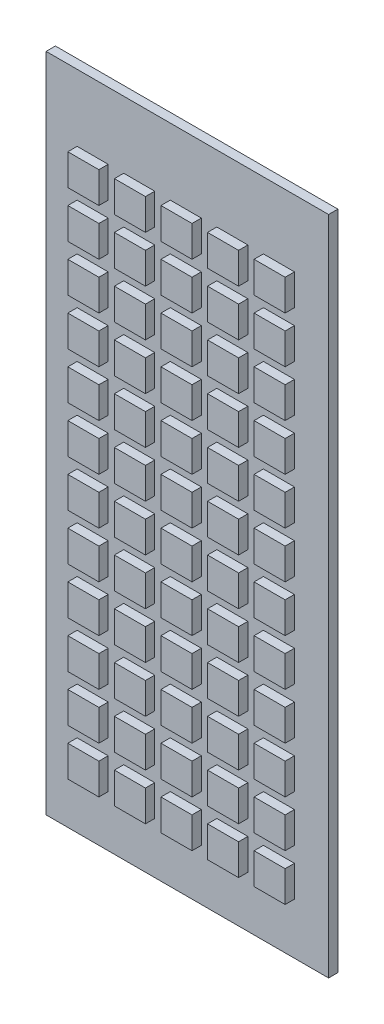
from build123d import *

# Parameters (mm, degrees)
CROQUIS1_W              = 910
CROQUIS1_H              = 2130
SALIENTE_EXTRUIR1_DEPTH = 30
CROQUIS2_W              = 100
CROQUIS2_H              = 100
SALIENTE_EXTRUIR2_DEPTH = 30


with BuildPart() as part:
    # Croquis1 → Saliente-Extruir1 (new body)
    with BuildSketch(Plane.XY):
        Rectangle(CROQUIS1_W, CROQUIS1_H)
    extrude(amount=SALIENTE_EXTRUIR1_DEPTH)

    # Croquis2 → Saliente-Extruir2 (add)
    with BuildSketch(Plane.XY.offset(30)):
        with Locations((-305, 800)):
            Rectangle(CROQUIS2_W, CROQUIS2_H)
        with Locations((-155, 800)):
            Rectangle(CROQUIS2_W, CROQUIS2_H)
        with Locations((-5, 800)):
            Rectangle(CROQUIS2_W, CROQUIS2_H)
        with Locations((145, 800)):
            Rectangle(CROQUIS2_W, CROQUIS2_H)
        with Locations((295, 800)):
            Rectangle(CROQUIS2_W, CROQUIS2_H)
        with Locations((-155, 650)):
            Rectangle(CROQUIS2_W, CROQUIS2_H)
        with Locations((-5, 650)):
            Rectangle(CROQUIS2_W, CROQUIS2_H)
        with Locations((145, 650)):
            Rectangle(CROQUIS2_W, CROQUIS2_H)
        with Locations((295, 650)):
            Rectangle(CROQUIS2_W, CROQUIS2_H)
        with Locations((-155, 500)):
            Rectangle(CROQUIS2_W, CROQUIS2_H)
        with Locations((-5, 500)):
            Rectangle(CROQUIS2_W, CROQUIS2_H)
        with Locations((145, 500)):
            Rectangle(CROQUIS2_W, CROQUIS2_H)
        with Locations((295, 500)):
            Rectangle(CROQUIS2_W, CROQUIS2_H)
        with Locations((-155, 350)):
            Rectangle(CROQUIS2_W, CROQUIS2_H)
        with Locations((-5, 350)):
            Rectangle(CROQUIS2_W, CROQUIS2_H)
        with Locations((145, 350)):
            Rectangle(CROQUIS2_W, CROQUIS2_H)
        with Locations((295, 350)):
            Rectangle(CROQUIS2_W, CROQUIS2_H)
        with Locations((-155, 200)):
            Rectangle(CROQUIS2_W, CROQUIS2_H)
        with Locations((-5, 200)):
            Rectangle(CROQUIS2_W, CROQUIS2_H)
        with Locations((145, 200)):
            Rectangle(CROQUIS2_W, CROQUIS2_H)
        with Locations((295, 200)):
            Rectangle(CROQUIS2_W, CROQUIS2_H)
        with Locations((-155, 50)):
            Rectangle(CROQUIS2_W, CROQUIS2_H)
        with Locations((-5, 50)):
            Rectangle(CROQUIS2_W, CROQUIS2_H)
        with Locations((145, 50)):
            Rectangle(CROQUIS2_W, CROQUIS2_H)
        with Locations((295, 50)):
            Rectangle(CROQUIS2_W, CROQUIS2_H)
        with Locations((-155, -100)):
            Rectangle(CROQUIS2_W, CROQUIS2_H)
        with Locations((-5, -100)):
            Rectangle(CROQUIS2_W, CROQUIS2_H)
        with Locations((145, -100)):
            Rectangle(CROQUIS2_W, CROQUIS2_H)
        with Locations((295, -100)):
            Rectangle(CROQUIS2_W, CROQUIS2_H)
        with Locations((-155, -250)):
            Rectangle(CROQUIS2_W, CROQUIS2_H)
        with Locations((-5, -250)):
            Rectangle(CROQUIS2_W, CROQUIS2_H)
        with Locations((145, -250)):
            Rectangle(CROQUIS2_W, CROQUIS2_H)
        with Locations((295, -250)):
            Rectangle(CROQUIS2_W, CROQUIS2_H)
        with Locations((-155, -400)):
            Rectangle(CROQUIS2_W, CROQUIS2_H)
        with Locations((-5, -400)):
            Rectangle(CROQUIS2_W, CROQUIS2_H)
        with Locations((145, -400)):
            Rectangle(CROQUIS2_W, CROQUIS2_H)
        with Locations((295, -400)):
            Rectangle(CROQUIS2_W, CROQUIS2_H)
        with Locations((-155, -550)):
            Rectangle(CROQUIS2_W, CROQUIS2_H)
        with Locations((-5, -550)):
            Rectangle(CROQUIS2_W, CROQUIS2_H)
        with Locations((145, -550)):
            Rectangle(CROQUIS2_W, CROQUIS2_H)
        with Locations((295, -550)):
            Rectangle(CROQUIS2_W, CROQUIS2_H)
        with Locations((-155, -700)):
            Rectangle(CROQUIS2_W, CROQUIS2_H)
        with Locations((-5, -700)):
            Rectangle(CROQUIS2_W, CROQUIS2_H)
        with Locations((145, -700)):
            Rectangle(CROQUIS2_W, CROQUIS2_H)
        with Locations((295, -700)):
            Rectangle(CROQUIS2_W, CROQUIS2_H)
        with Locations((-155, -850)):
            Rectangle(CROQUIS2_W, CROQUIS2_H)
        with Locations((-5, -850)):
            Rectangle(CROQUIS2_W, CROQUIS2_H)
        with Locations((145, -850)):
            Rectangle(CROQUIS2_W, CROQUIS2_H)
        with Locations((295, -850)):
            Rectangle(CROQUIS2_W, CROQUIS2_H)
        with Locations((-305, 650)):
            Rectangle(CROQUIS2_W, CROQUIS2_H)
        with Locations((-305, 500)):
            Rectangle(CROQUIS2_W, CROQUIS2_H)
        with Locations((-305, 350)):
            Rectangle(CROQUIS2_W, CROQUIS2_H)
        with Locations((-305, 200)):
            Rectangle(CROQUIS2_W, CROQUIS2_H)
        with Locations((-305, 50)):
            Rectangle(CROQUIS2_W, CROQUIS2_H)
        with Locations((-305, -100)):
            Rectangle(CROQUIS2_W, CROQUIS2_H)
        with Locations((-305, -250)):
            Rectangle(CROQUIS2_W, CROQUIS2_H)
        with Locations((-305, -400)):
            Rectangle(CROQUIS2_W, CROQUIS2_H)
        with Locations((-305, -550)):
            Rectangle(CROQUIS2_W, CROQUIS2_H)
        with Locations((-305, -700)):
            Rectangle(CROQUIS2_W, CROQUIS2_H)
        with Locations((-305, -850)):
            Rectangle(CROQUIS2_W, CROQUIS2_H)
    extrude(amount=SALIENTE_EXTRUIR2_DEPTH)


solid = part.part
